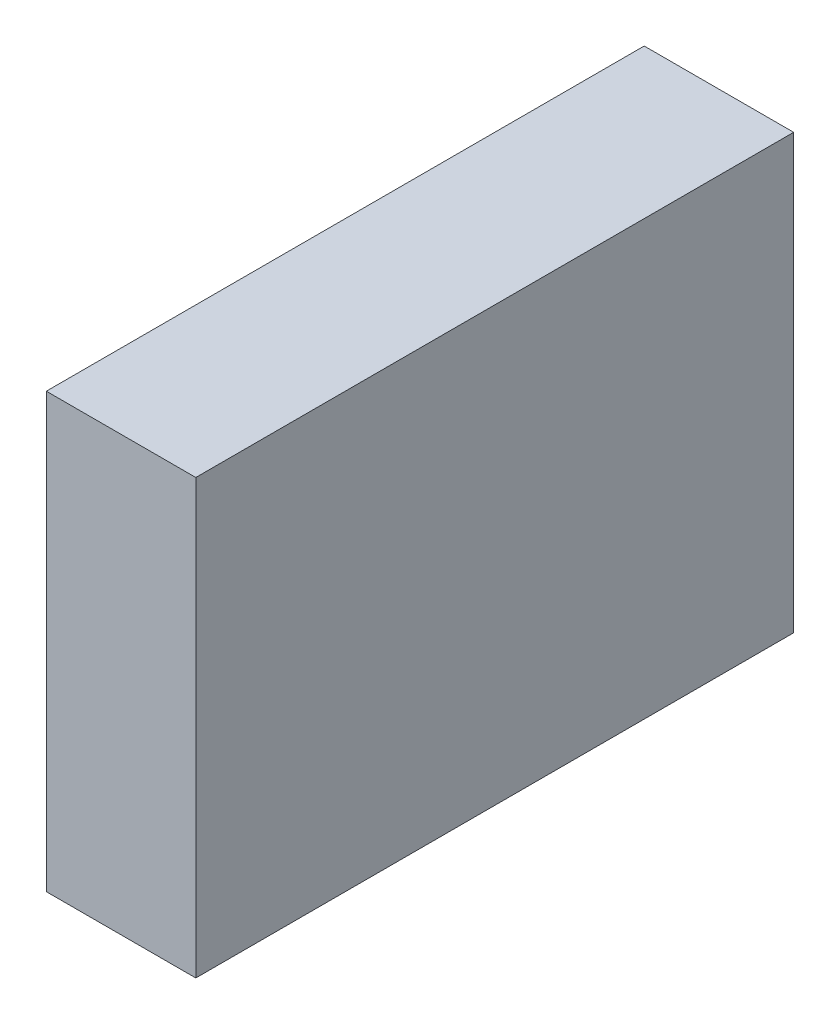
from build123d import *

# Parameters (mm, degrees)
SKETCH1_W           = 40
SKETCH1_H           = 29
BOSS_EXTRUDE1_DEPTH = 10


with BuildPart() as part:
    # Sketch1 → Boss-Extrude1 (new body)
    with BuildSketch(Plane(origin=(0, 0, 0), x_dir=(0, 0, -1), z_dir=(1, 0, 0))):
        with Locations((20, 14.5)):
            Rectangle(SKETCH1_W, SKETCH1_H)
    extrude(amount=BOSS_EXTRUDE1_DEPTH)


solid = part.part
